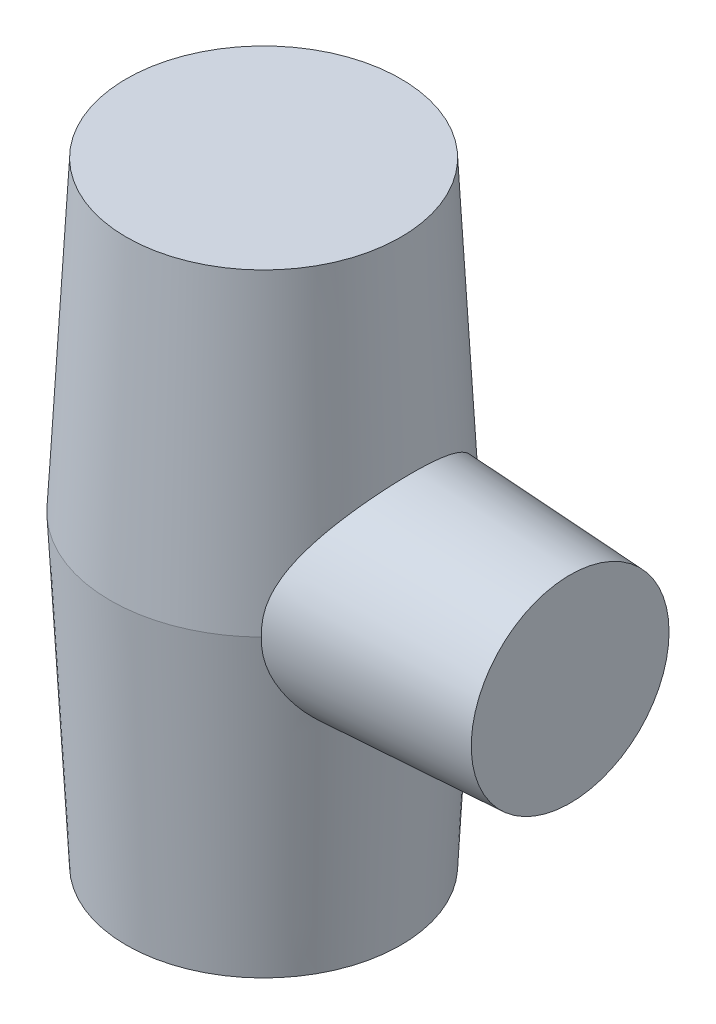
from build123d import *

# Parameters (mm, degrees)
SKETCH1_R                     = 1.27
BOSS_EXTRUDE1_DEPTH           = 2.54
BOSS_EXTRUDE1_TAPER           = 3
BOSS_EXTRUDE1_OTHER_WAY_DEPTH = 2.54
BOSS_EXTRUDE1_OTHER_WAY_TAPER = 3
SKETCH2_R                     = 0.9525
BOSS_EXTRUDE2_DEPTH           = 2.54
BOSS_EXTRUDE2_TAPER           = 3


with BuildPart() as part:
    # Sketch1 → Boss-Extrude1 (new body)
    with BuildSketch(Plane(origin=(0, 0, 0), x_dir=(1, 0, 0), z_dir=(0, 1, 0))):
        Circle(SKETCH1_R)
    extrude(amount=BOSS_EXTRUDE1_DEPTH, taper=BOSS_EXTRUDE1_TAPER)

    # Sketch1 → Boss-Extrude1 other way (add)
    with BuildSketch(Plane(origin=(0, 0, 0), x_dir=(1, 0, 0), z_dir=(0, 1, 0))):
        Circle(SKETCH1_R)
    extrude(amount=-BOSS_EXTRUDE1_OTHER_WAY_DEPTH, taper=BOSS_EXTRUDE1_OTHER_WAY_TAPER)

    # Sketch2 → Boss-Extrude2 (add)
    with BuildSketch(Plane(origin=(0, 0, 0), x_dir=(0, 0, -1), z_dir=(1, 0, 0))):
        Circle(SKETCH2_R)
    extrude(amount=BOSS_EXTRUDE2_DEPTH, taper=BOSS_EXTRUDE2_TAPER)


solid = part.part
